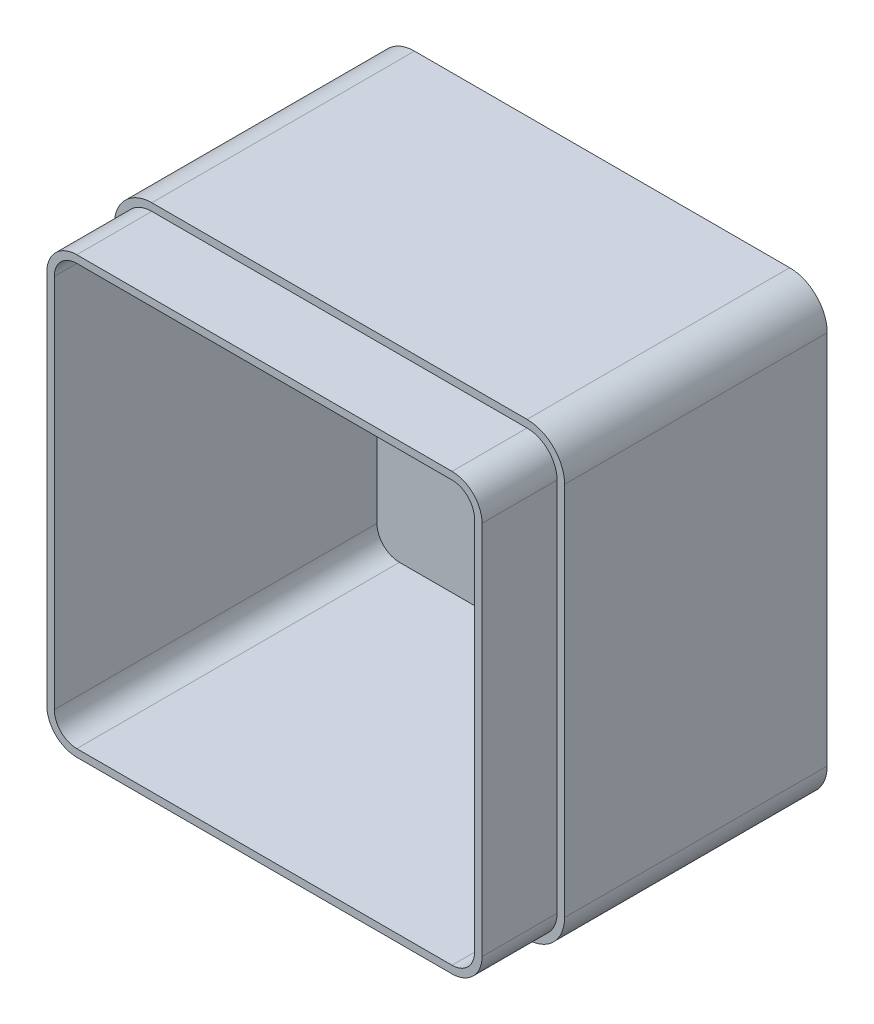
from build123d import *

# Parameters (mm, degrees)
SKETCH_1_W          = 120
SKETCH_1_H          = 120
EXTRUDE_1_DEPTH     = 90
FILLET_1_R          = 10
SHELL_1_T           = -4
CUT_EXTRUDE_1_DEPTH = 20


with BuildPart() as part:
    # 草圖1 → 填料-伸長1 (new body)
    with BuildSketch(Plane.XY):
        Rectangle(SKETCH_1_W, SKETCH_1_H)
    extrude(amount=EXTRUDE_1_DEPTH)

    # 圓角1
    fillet_1_edges = [part.edges().sort_by_distance(p)[0] for p in [
        (60, -60, 45),
        (-60, -60, 45),
        (-60, 60, 45),
        (60, 60, 45),
    ]]
    fillet(fillet_1_edges, radius=FILLET_1_R)

    # 薄殼1
    shell_1_openings = [part.faces().sort_by_distance(p)[0] for p in [
        (0, 0, 90),
    ]]
    offset(amount=SHELL_1_T, openings=shell_1_openings, kind=Kind.INTERSECTION)

    # 草圖10 → 除料-伸長1 (cut)
    with BuildSketch(Plane.XY.offset(90)):
        with BuildLine():
            Line((60, -50), (60, 50))
            ThreePointArc((60, 50), (57.071067812, 57.071067812), (50, 60))
            Line((50, 60), (-50, 60))
            ThreePointArc((-50, 60), (-57.071067812, 57.071067812), (-60, 50))
            Line((-60, 50), (-60, -50))
            ThreePointArc((-60, -50), (-57.071067812, -57.071067812), (-50, -60))
            Line((-50, -60), (50, -60))
            ThreePointArc((50, -60), (57.071067812, -57.071067812), (60, -50))
        make_face()
        with BuildLine():
            Line((-58, 50), (-58, -50))
            ThreePointArc((-58, -50), (-55.656854249, -55.656854249), (-50, -58))
            Line((-50, -58), (50, -58))
            ThreePointArc((50, -58), (55.656854249, -55.656854249), (58, -50))
            Line((58, -50), (58, 50))
            ThreePointArc((58, 50), (55.656854249, 55.656854249), (50, 58))
            Line((50, 58), (-50, 58))
            ThreePointArc((-50, 58), (-55.656854249, 55.656854249), (-58, 50))
        make_face(mode=Mode.SUBTRACT)
    extrude(amount=-CUT_EXTRUDE_1_DEPTH, mode=Mode.SUBTRACT)


solid = part.part
